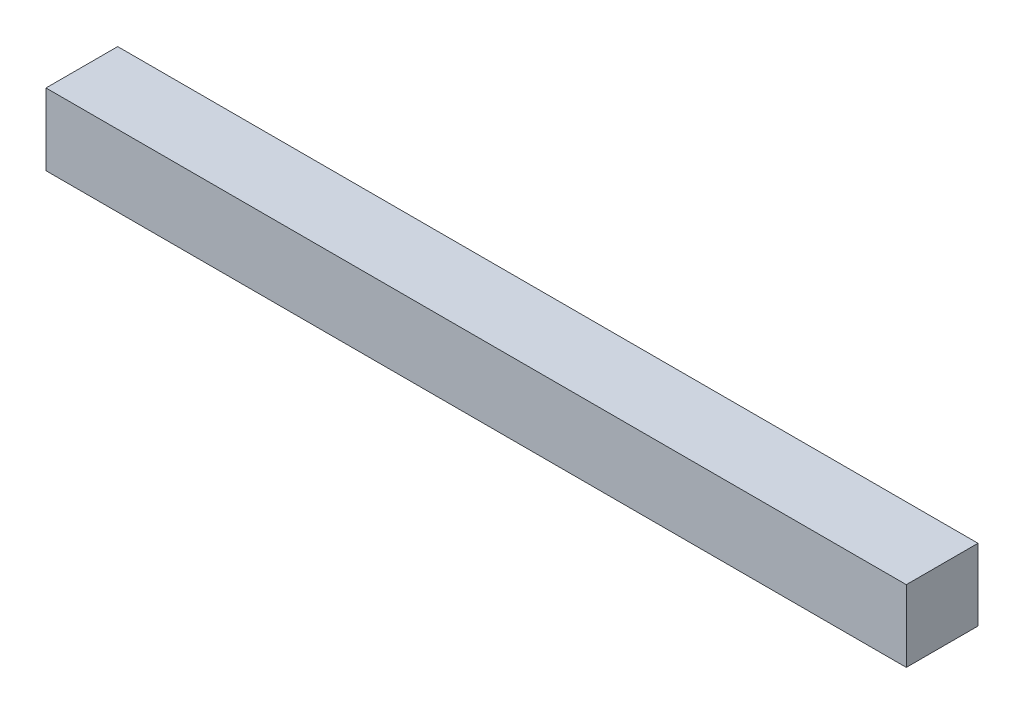
from build123d import *

# Parameters (mm, degrees)
SKETCH1_W           = 228.6
SKETCH1_H           = 19.05
BOSS_EXTRUDE1_DEPTH = 19.05


with BuildPart() as part:
    # Sketch1 → Boss-Extrude1 (new body)
    with BuildSketch(Plane(origin=(0, 0, 0), x_dir=(1, 0, 0), z_dir=(0, 1, 0))):
        with Locations((114.3, 9.525)):
            Rectangle(SKETCH1_W, SKETCH1_H)
    extrude(amount=BOSS_EXTRUDE1_DEPTH)


solid = part.part
